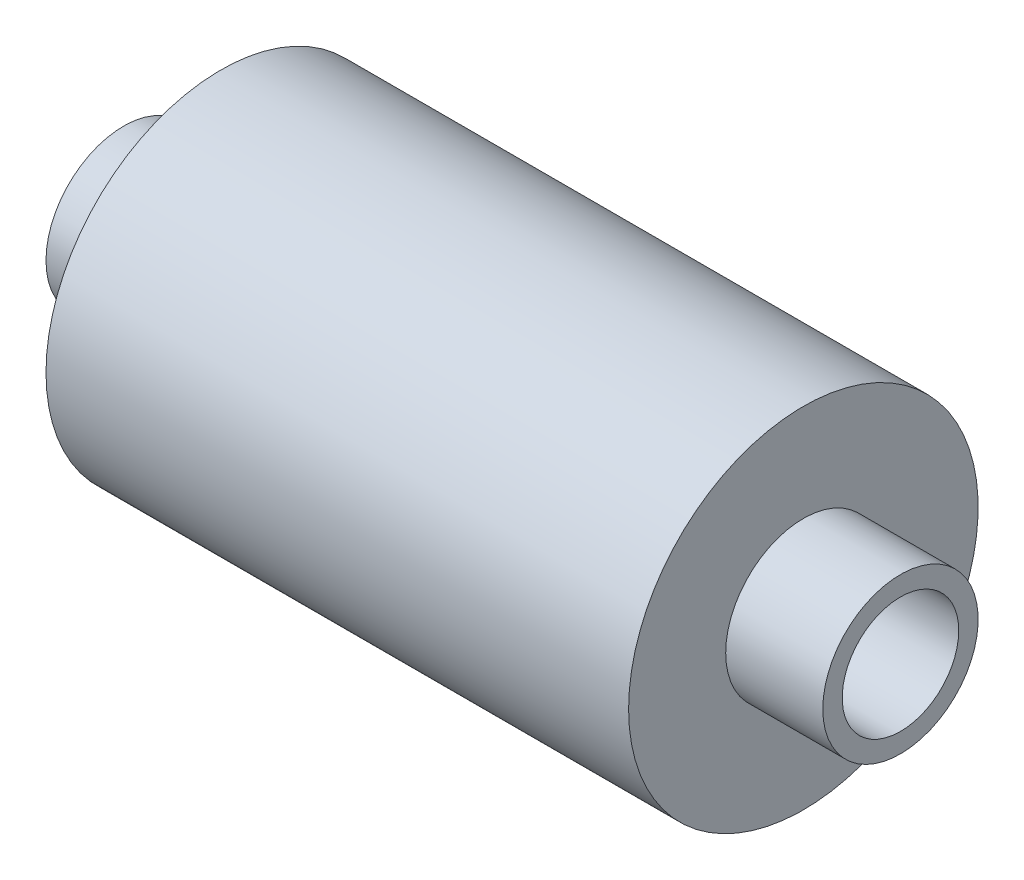
from build123d import *

# Parameters (mm, degrees)
SKETCH1_R           = 9
SKETCH1_R_2         = 3
BOSS_EXTRUDE1_DEPTH = 40
SKETCH2_W           = 5
SKETCH2_H           = 5


with BuildPart() as part:
    # Sketch1 → Boss-Extrude1 (new body)
    with BuildSketch(Plane(origin=(0, 0, 0), x_dir=(0, 0, -1), z_dir=(1, 0, 0))):
        Circle(SKETCH1_R)
        Circle(SKETCH1_R_2, mode=Mode.SUBTRACT)
    extrude(amount=BOSS_EXTRUDE1_DEPTH)

    # Sketch2 → Cut-Revolve1 (revolve, cut)
    with BuildSketch(Plane.XY, mode=Mode.PRIVATE) as cut_revolve1_sk:
        with Locations((2.5, 6.5)):
            Rectangle(SKETCH2_W, SKETCH2_H)
        with Locations((37.5, 6.5)):
            Rectangle(SKETCH2_W, SKETCH2_H)
    revolve(cut_revolve1_sk.sketch.rotate(Axis((0, 0, 0), (1, 0, 0)), 90), axis=Axis((0, 0, 0), (1, 0, 0)), mode=Mode.SUBTRACT)


solid = part.part
